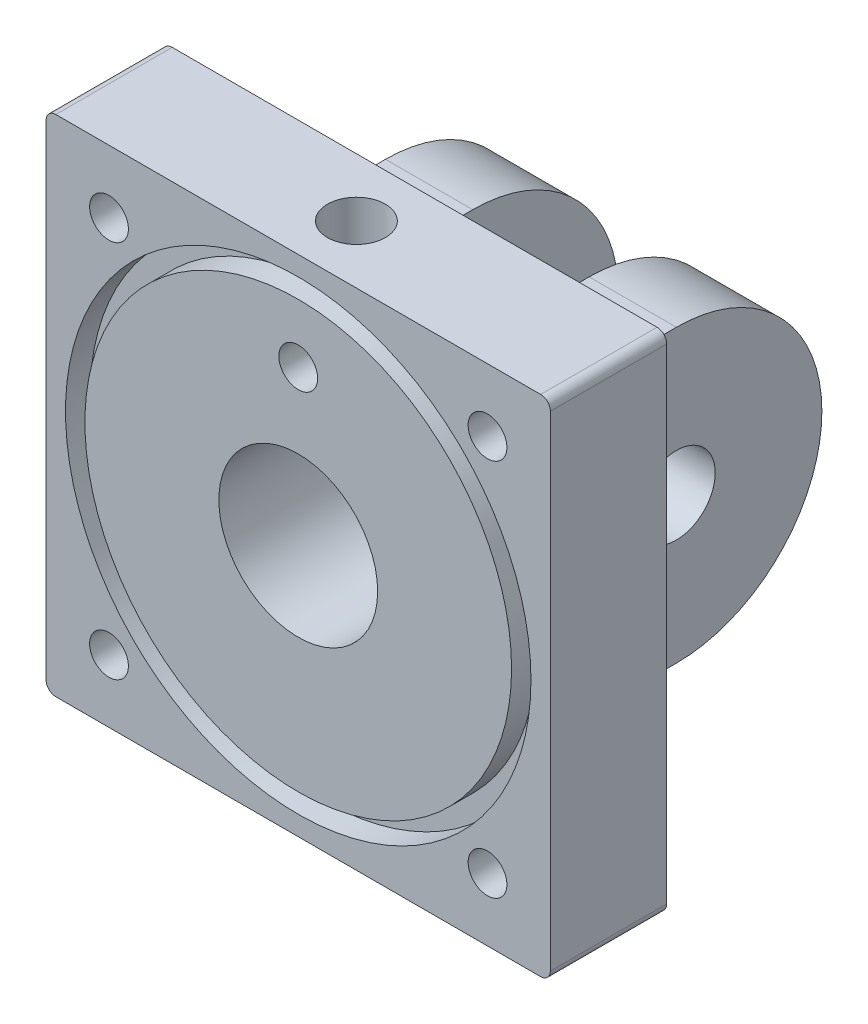
from build123d import *

# Parameters (mm, degrees)
SKETCH1_W                        = 165.1
SKETCH1_H                        = 165.1
BOSS_EXTRUDE1_DEPTH              = 38.1
SKETCH2_W                        = 95.25
SKETCH2_H                        = 95.25
BOSS_EXTRUDE2_DEPTH              = 38.1
BOSS_EXTRUDE3_DEPTH              = 95.25
SKETCH4_R                        = 12.7
CUT_EXTRUDE1_DEPTH               = 177.376894037
SKETCH5_W                        = 38.1
SKETCH5_H                        = 85.725
CUT_EXTRUDE2_DEPTH               = 177.376894037
FILLET1_R                        = 3.175
SKETCH6_R                        = 26
CUT_EXTRUDE3_DEPTH               = 36.83
SKETCH7_R                        = 76.2
SKETCH7_R_2                      = 69.85
CUT_EXTRUDE4_DEPTH               = 8
F_1_2_14_NPSM_TAPPED_HOLE1_D     = 18.9738
F_1_2_14_NPSM_TAPPED_HOLE1_DEPTH = 47.25
F_1_2_14_NPSM_TAPPED_HOLE1_TIP   = 5.700304607
SKETCH11_R                       = 6.35
CUT_EXTRUDE5_DEPTH               = 20
SKETCH12_R                       = 6.35
CUT_EXTRUDE6_DEPTH               = 171.181184746


with BuildPart() as part:
    # Sketch1 → Boss-Extrude1 (new body)
    with BuildSketch(Plane.XY):
        Rectangle(SKETCH1_W, SKETCH1_H)
    extrude(amount=BOSS_EXTRUDE1_DEPTH)

    # Sketch2 → Boss-Extrude2 (add)
    with BuildSketch(Plane(origin=(0, 0, 0), x_dir=(-1, 0, 0), z_dir=(0, 0, -1))):
        Rectangle(SKETCH2_W, SKETCH2_H)
    extrude(amount=BOSS_EXTRUDE2_DEPTH)

    # Sketch3 → Boss-Extrude3 (add)
    with BuildSketch(Plane(origin=(47.625, 0, 0), x_dir=(0, 0, -1), z_dir=(1, 0, 0))):
        with BuildLine():
            Line((38.1, -47.625), (38.1, 47.625))
            ThreePointArc((38.1, 47.625), (85.725, 0), (38.1, -47.625))
        make_face()
    extrude(amount=-BOSS_EXTRUDE3_DEPTH)

    # Sketch4 → Cut-Extrude1 (cut, through all)
    with BuildSketch(Plane(origin=(47.625, 0, 0), x_dir=(0, 0, -1), z_dir=(1, 0, 0))):
        with Locations((38.1, 0)):
            Circle(SKETCH4_R)
    extrude(amount=-CUT_EXTRUDE1_DEPTH, mode=Mode.SUBTRACT)

    # Sketch5 → Cut-Extrude2 (cut, through all)
    with BuildSketch(Plane(origin=(0, 47.625, 0), x_dir=(1, 0, 0), z_dir=(0, 1, 0))):
        with Locations((0, 42.8625)):
            Rectangle(SKETCH5_W, SKETCH5_H)
    extrude(amount=-CUT_EXTRUDE2_DEPTH, mode=Mode.SUBTRACT)

    # Fillet1
    fillet1_edges = [part.edges().sort_by_distance(p)[0] for p in [
        (-82.55, 82.55, 19.05),
        (82.55, 82.55, 19.05),
        (82.55, -82.55, 19.05),
        (-82.55, -82.55, 19.05),
    ]]
    fillet(fillet1_edges, radius=FILLET1_R)

    # Sketch6 → Cut-Extrude3 (cut)
    with BuildSketch(Plane.XY.offset(38.1)):
        Circle(SKETCH6_R)
    extrude(amount=-CUT_EXTRUDE3_DEPTH, mode=Mode.SUBTRACT)

    # Sketch7 → Cut-Extrude4 (cut)
    with BuildSketch(Plane.XY.offset(38.1)):
        Circle(SKETCH7_R)
        Circle(SKETCH7_R_2, mode=Mode.SUBTRACT)
    extrude(amount=-CUT_EXTRUDE4_DEPTH, mode=Mode.SUBTRACT)

    # 1/2-14 NPSM Tapped Hole1
    with Locations(Plane(origin=(0, 82.55, 0), x_dir=(1, 0, 0), z_dir=(0, 1, 0))):
        with Locations((0, -19.05)):
            Hole(F_1_2_14_NPSM_TAPPED_HOLE1_D / 2, depth=F_1_2_14_NPSM_TAPPED_HOLE1_DEPTH)
            with Locations((0, 0, -(F_1_2_14_NPSM_TAPPED_HOLE1_DEPTH + F_1_2_14_NPSM_TAPPED_HOLE1_TIP / 2))):  # 118° drill point
                Cone(0, F_1_2_14_NPSM_TAPPED_HOLE1_D / 2, F_1_2_14_NPSM_TAPPED_HOLE1_TIP, mode=Mode.SUBTRACT)

    # Sketch11 → Cut-Extrude5 (cut)
    with BuildSketch(Plane.XY.offset(38.1)):
        with Locations((0, 50.55)):
            Circle(SKETCH11_R)
    extrude(amount=-CUT_EXTRUDE5_DEPTH, mode=Mode.SUBTRACT)

    # Sketch12 → Cut-Extrude6 (cut, through all)
    with BuildSketch(Plane.XY.offset(38.1)):
        with Locations((-61.963767235, 61.963767235)):
            Circle(SKETCH12_R)
        with Locations((61.963767235, 61.963767235)):
            Circle(SKETCH12_R)
        with Locations((61.963767235, -61.963767235)):
            Circle(SKETCH12_R)
        with Locations((-61.963767235, -61.963767235)):
            Circle(SKETCH12_R)
    extrude(amount=-CUT_EXTRUDE6_DEPTH, mode=Mode.SUBTRACT)


solid = part.part
